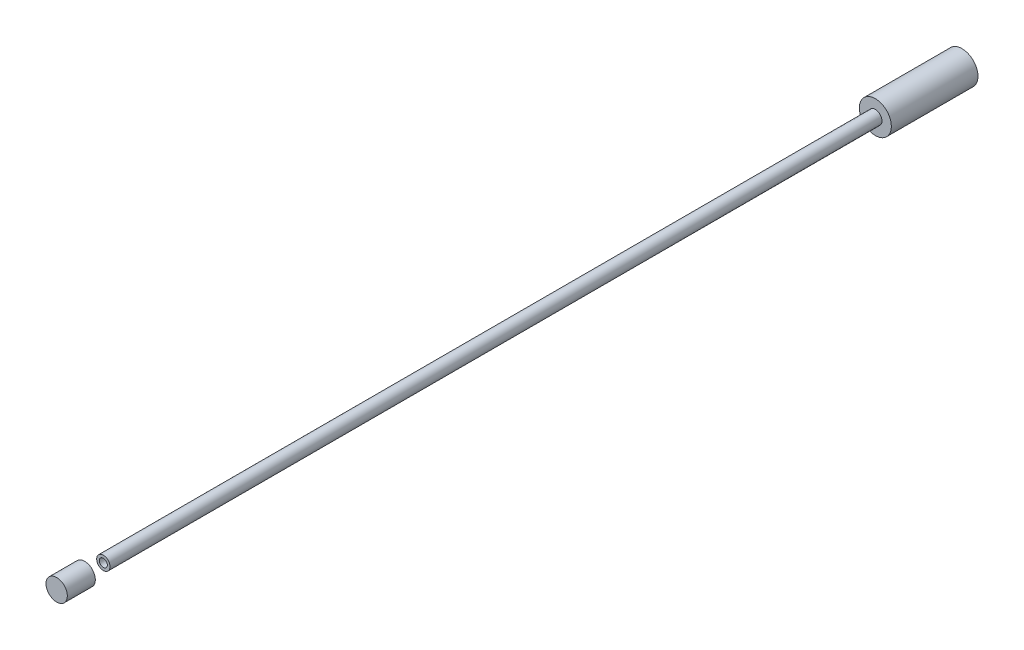
from build123d import *

# Parameters (mm, degrees)
EXTRUDE_START        = -335
EXTRUDE_SKETCH_1_R   = 12
EXTRUDE_1_DEPTH      = 65
EXTRUDE_START_2      = -270
EXTRUDE_SKETCH_2_R   = 5
EXTRUDE_SKETCH_2_R_2 = 3
EXTRUDE_2_DEPTH      = 579
EXTRUDE_START_3      = 323
EXTRUDE_SKETCH_3_R   = 8
EXTRUDE_3_DEPTH      = 21


with BuildPart() as part:
    # Extrude sketch 1 → Extrude 1 (new body)
    with BuildSketch(Plane.XY.offset(EXTRUDE_START)):
        with Locations((285, 0)):
            Circle(EXTRUDE_SKETCH_1_R)
    extrude(amount=EXTRUDE_1_DEPTH)


with BuildPart() as body_2:
    # Extrude sketch 2 → Extrude 2 (new body)
    with BuildSketch(Plane.XY.offset(EXTRUDE_START_2)):
        with Locations((285, 0)):
            Circle(EXTRUDE_SKETCH_2_R)
        with Locations((285, 0)):
            Circle(EXTRUDE_SKETCH_2_R_2, mode=Mode.SUBTRACT)
    extrude(amount=EXTRUDE_2_DEPTH)


with BuildPart() as body_3:
    # Extrude sketch 3 → Extrude 3 (new body)
    with BuildSketch(Plane.XY.offset(EXTRUDE_START_3)):
        with Locations(Location((285, 0, 0), (0, 0, 180))):
            Circle(EXTRUDE_SKETCH_3_R)
    extrude(amount=EXTRUDE_3_DEPTH)


solid = Compound([part.part, body_2.part, body_3.part])
